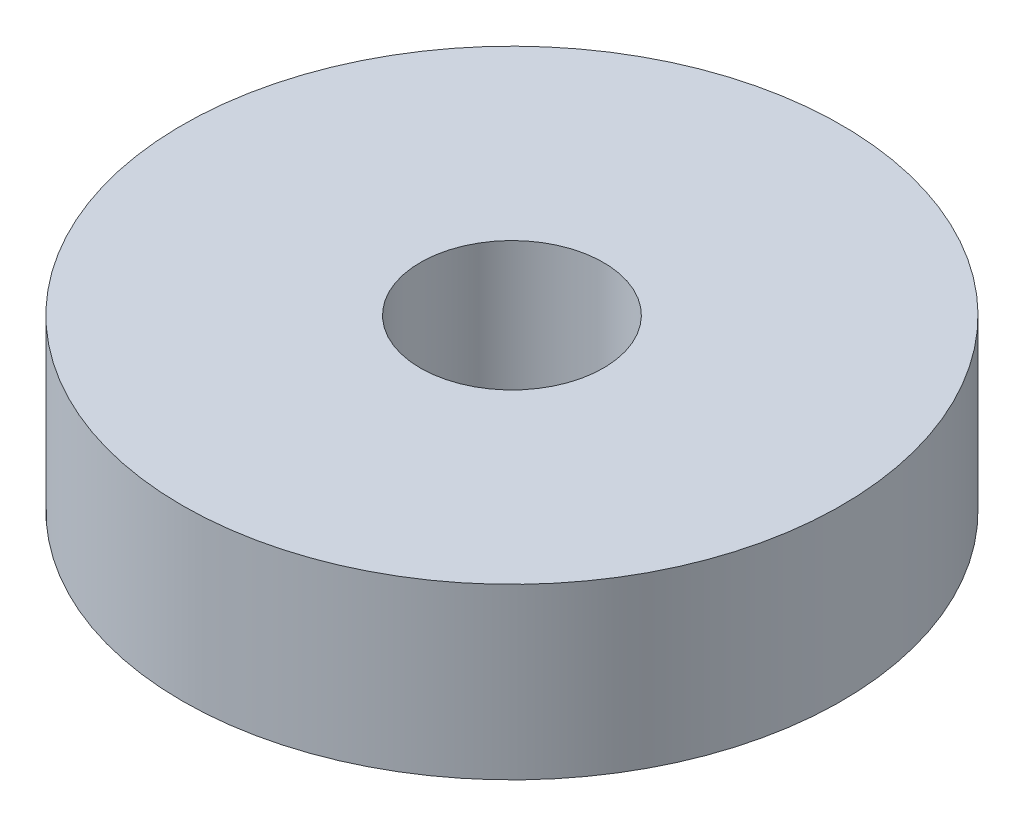
from build123d import *

# Parameters (mm, degrees)
SKETCH2_R           = 18
SKETCH2_R_2         = 5
BOSS_EXTRUDE1_DEPTH = 9.25


with BuildPart() as part:
    # Sketch2 → Boss-Extrude1 (new body)
    with BuildSketch(Plane(origin=(0, 0, 0), x_dir=(1, 0, 0), z_dir=(0, 1, 0))):
        with Locations(Location((0, 0, 0), (0, 0, 270))):
            Circle(SKETCH2_R)
        with Locations(Location((0, 0, 0), (0, 0, 270))):
            Circle(SKETCH2_R_2, mode=Mode.SUBTRACT)
    extrude(amount=BOSS_EXTRUDE1_DEPTH)


solid = part.part
